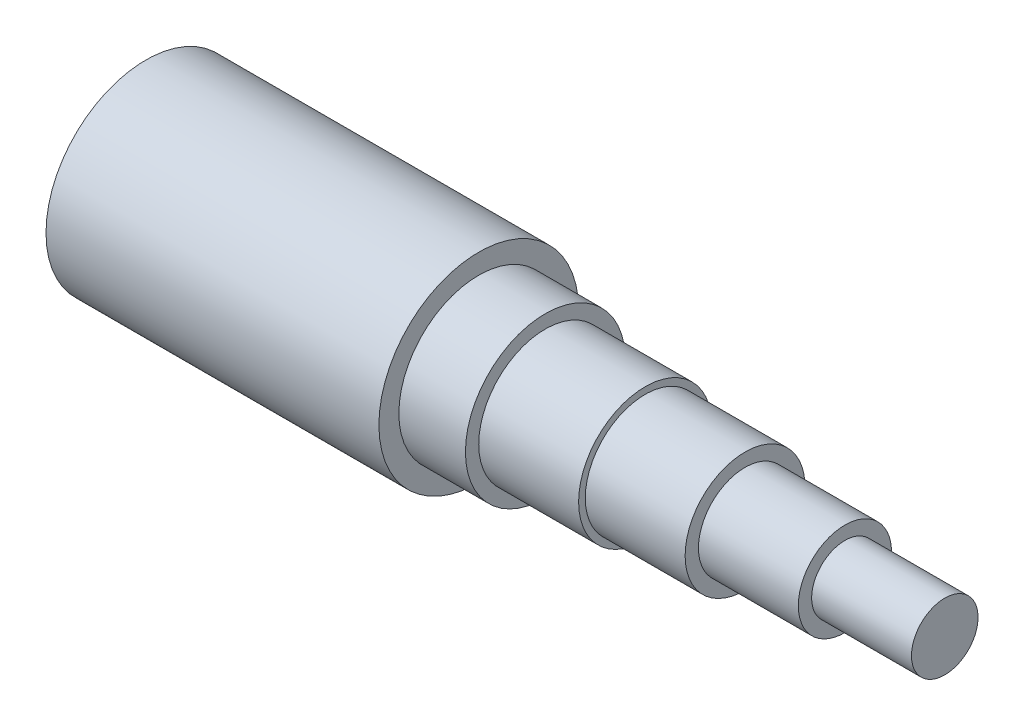
from build123d import *

# Parameters (mm, degrees)
SKETCH1_W = 9.525
SKETCH1_H = 3.175


with BuildPart() as part:
    # Sketch1 → Revolve2 (revolve)
    with BuildSketch(Plane.XY, mode=Mode.PRIVATE) as revolve2_sk:
        Polygon((0, 9.525), (0, 0), (31.75, 0), (31.75, 7.62), (31.75, 9.525), align=None)
        Polygon((31.75, 7.62), (31.75, 0), (38.1, 0), (38.1, 6.35), (38.1, 7.62), align=None)
        Polygon((38.1, 6.35), (38.1, 0), (47.625, 0), (47.625, 5.715), (47.625, 6.35), align=None)
        Polygon((47.625, 5.715), (47.625, 0), (57.15, 0), (57.15, 4.445), (57.15, 5.715), align=None)
        Polygon((57.15, 4.445), (57.15, 0), (66.675, 0), (66.675, 3.175), (66.675, 4.445), align=None)
        with Locations((71.4375, 1.5875)):
            Rectangle(SKETCH1_W, SKETCH1_H)
    revolve(revolve2_sk.sketch.rotate(Axis((0, 0, 0), (1, 0, 0)), 90), axis=Axis((0, 0, 0), (1, 0, 0)))


solid = part.part
